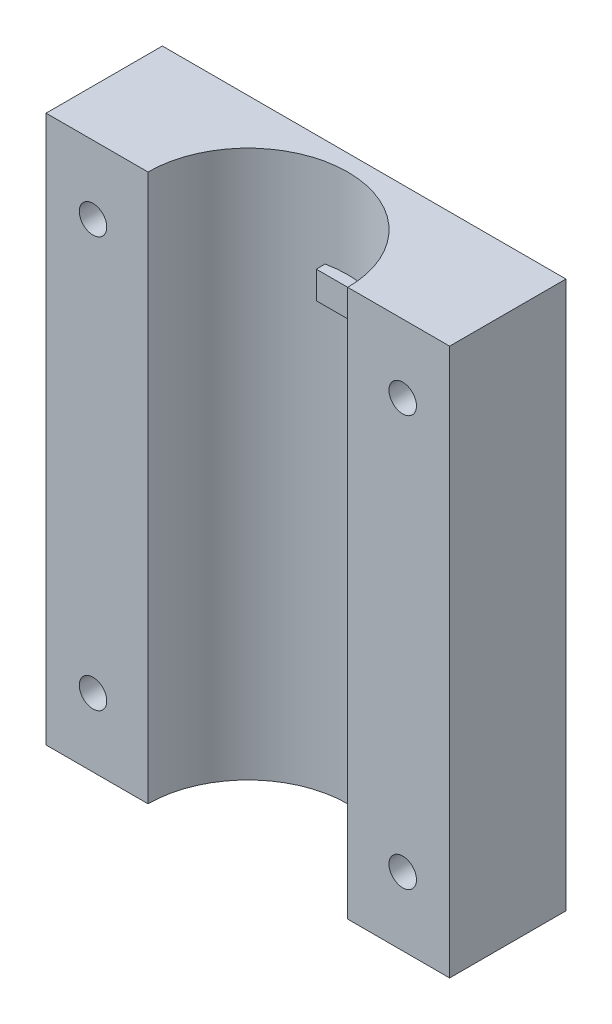
from build123d import *

# Parameters (mm, degrees)
SKETCH1_W                   = 74.93
SKETCH1_H                   = 101.6
BOSS_EXTRUDE2_DEPTH         = 21.59
CUT_EXTRUDE2_DEPTH          = 111.418813275
CUT_EXTRUDE2_DEPTH_BACK     = 111.418813275
SKETCH4_W                   = 7.62
SKETCH4_H                   = 5.08
BOSS_EXTRUDE3_DEPTH         = 2.54
TAP_DRILL_FOR_1_4_20_TAP1_D = 5.1054


with BuildPart() as part:
    # Sketch1 → Boss-Extrude2 (new body)
    with BuildSketch(Plane.XY):
        Rectangle(SKETCH1_W, SKETCH1_H)
    extrude(amount=-BOSS_EXTRUDE2_DEPTH)

    # Sketch2 → Cut-Extrude2 (cut, two sides: drawn at the far end of the back side and taken through both)
    with BuildSketch(Plane(origin=(0, 50.8, 0), x_dir=(1, 0, 0), z_dir=(0, 1, 0)).offset(-CUT_EXTRUDE2_DEPTH_BACK)):
        with BuildLine():
            Line((-18.542, -130.048526005), (-18.542, 0))
            ThreePointArc((-18.542, 0), (0, 18.542), (18.542, 0))
            Line((18.542, 0), (18.542, -130.048526005))
            Line((18.542, -130.048526005), (18.542, -390.145578015))
            Line((18.542, -390.145578015), (-18.542, -390.145578015))
            Line((-18.542, -390.145578015), (-18.542, -130.048526005))
        make_face()
    extrude(amount=CUT_EXTRUDE2_DEPTH + CUT_EXTRUDE2_DEPTH_BACK, mode=Mode.SUBTRACT)

    # Sketch4 → Boss-Extrude3 (add, symmetric)
    with BuildSketch(Plane(origin=(0, 31.75, 0), x_dir=(1, 0, 0), z_dir=(0, 1, 0))):
        with Locations((0, 19.05)):
            Rectangle(SKETCH4_W, SKETCH4_H)
    extrude(amount=BOSS_EXTRUDE3_DEPTH, both=True)

    # Tap Drill for 1/4-20 Tap1 (through all)
    with Locations(Plane.XY):
        with Locations((-28.7528, 38.1), (28.7528, 38.1), (-28.7528, -38.1), (28.7528, -38.1)):
            Hole(TAP_DRILL_FOR_1_4_20_TAP1_D / 2)


solid = part.part
